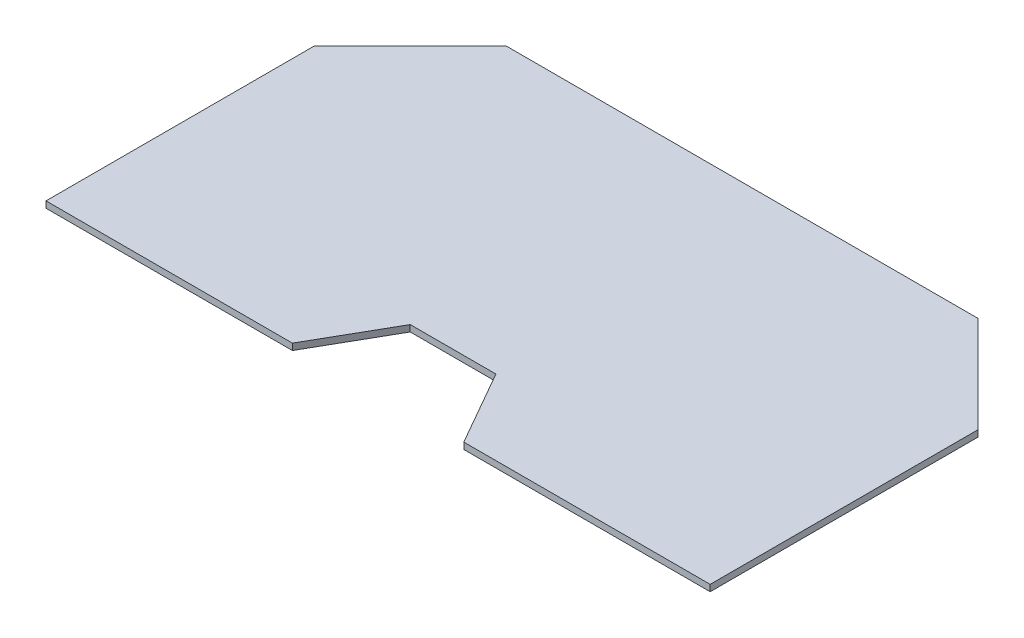
from build123d import *

# Parameters (mm, degrees)
SKETCH_1_W               = 310
SKETCH_1_H               = 170
EXTRUDE_1_DEPTH          = 3
CUT_EXTRUDE_1_DEPTH      = 177.802149308
CUT_EXTRUDE_1_DEPTH_BACK = 177.802149308
CHAMFER_1_SIZE           = 45


with BuildPart() as part:
    # 草图1 → 凸台-拉伸1 (new body)
    with BuildSketch(Plane(origin=(0, 0, 0), x_dir=(1, 0, 0), z_dir=(0, 1, 0))):
        Rectangle(SKETCH_1_W, SKETCH_1_H)
    extrude(amount=EXTRUDE_1_DEPTH)

    # 草图2 → 切除-拉伸1 (cut, two sides: drawn at the far end of the back side and taken through both)
    with BuildSketch(Plane(origin=(0, 3, 0), x_dir=(1, 0, 0), z_dir=(0, 1, 0)).offset(-CUT_EXTRUDE_1_DEPTH_BACK)):
        Polygon((-20, -50), (-40, -85), (40, -85), (20, -50), align=None)
    extrude(amount=CUT_EXTRUDE_1_DEPTH + CUT_EXTRUDE_1_DEPTH_BACK, mode=Mode.SUBTRACT)

    # 倒角1
    chamfer_1_edges = [part.edges().sort_by_distance(p)[0] for p in [
        (-155, 1.5, -85),
        (155, 1.5, -85),
    ]]
    chamfer(chamfer_1_edges, length=CHAMFER_1_SIZE)


solid = part.part
